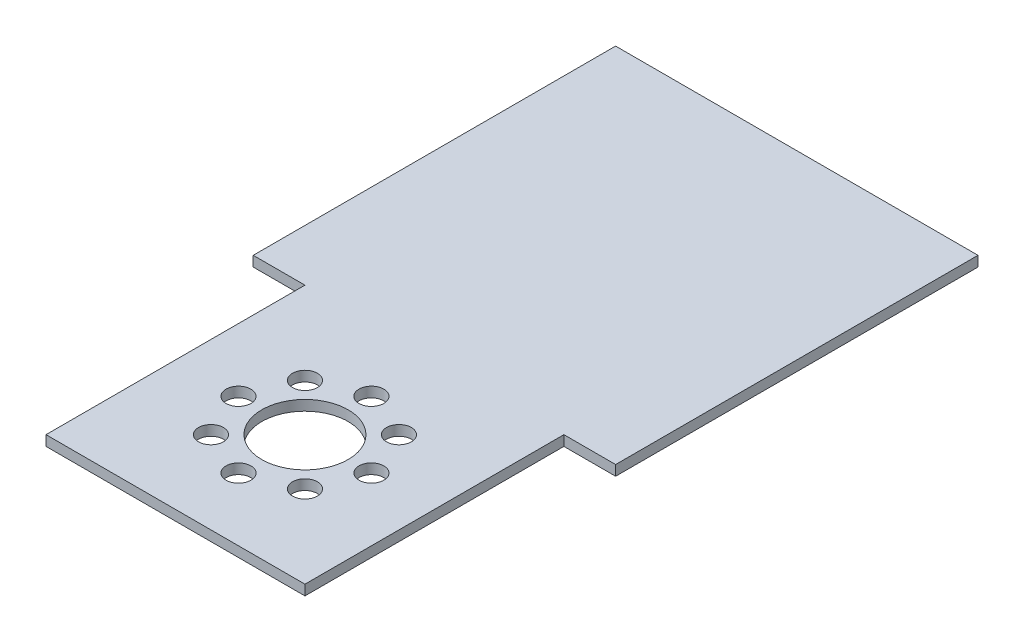
from build123d import *

# Parameters (mm, degrees)
SKETCH1_R           = 1.8288
SKETCH1_R_2         = 6.35
BOSS_EXTRUDE1_DEPTH = 1.5


with BuildPart() as part:
    # Sketch1 → Boss-Extrude1 (new body)
    with BuildSketch(Plane(origin=(0, 0, 0), x_dir=(1, 0, 0), z_dir=(0, 1, 0))):
        Polygon((-21.410875754, -45.056521739), (16.689124246, -45.056521739), (16.689124246, -6.956521739), (24.298964246, -6.956521739), (24.298964246, 46.363158261), (-29.020715754, 46.363158261), (-29.020715754, -6.956521739), (-21.410875754, -6.956521739), align=None)
        with Locations(Location((-9.275672968, -19.091724526, 0), (0, 0, 270))):
            Circle(SKETCH1_R, mode=Mode.SUBTRACT)
        with Locations(Location((-2.360875754, -16.227521739, 0), (0, 0, 270))):
            Circle(SKETCH1_R, mode=Mode.SUBTRACT)
        with Locations(Location((-12.139875754, -26.006521739, 0), (0, 0, 270))):
            Circle(SKETCH1_R, mode=Mode.SUBTRACT)
        with Locations(Location((4.553921459, -19.091724526, 0), (0, 0, 270))):
            Circle(SKETCH1_R, mode=Mode.SUBTRACT)
        with Locations(Location((7.418124246, -26.006521739, 0), (0, 0, 270))):
            Circle(SKETCH1_R, mode=Mode.SUBTRACT)
        with Locations(Location((4.553921459, -32.921318952, 0), (0, 0, 270))):
            Circle(SKETCH1_R, mode=Mode.SUBTRACT)
        with Locations(Location((-2.360875754, -35.785521739, 0), (0, 0, 270))):
            Circle(SKETCH1_R, mode=Mode.SUBTRACT)
        with Locations(Location((-9.275672968, -32.921318952, 0), (0, 0, 270))):
            Circle(SKETCH1_R, mode=Mode.SUBTRACT)
        with Locations(Location((-2.360875754, -26.006521739, 0), (0, 0, 270))):
            Circle(SKETCH1_R_2, mode=Mode.SUBTRACT)
    extrude(amount=BOSS_EXTRUDE1_DEPTH)


solid = part.part
